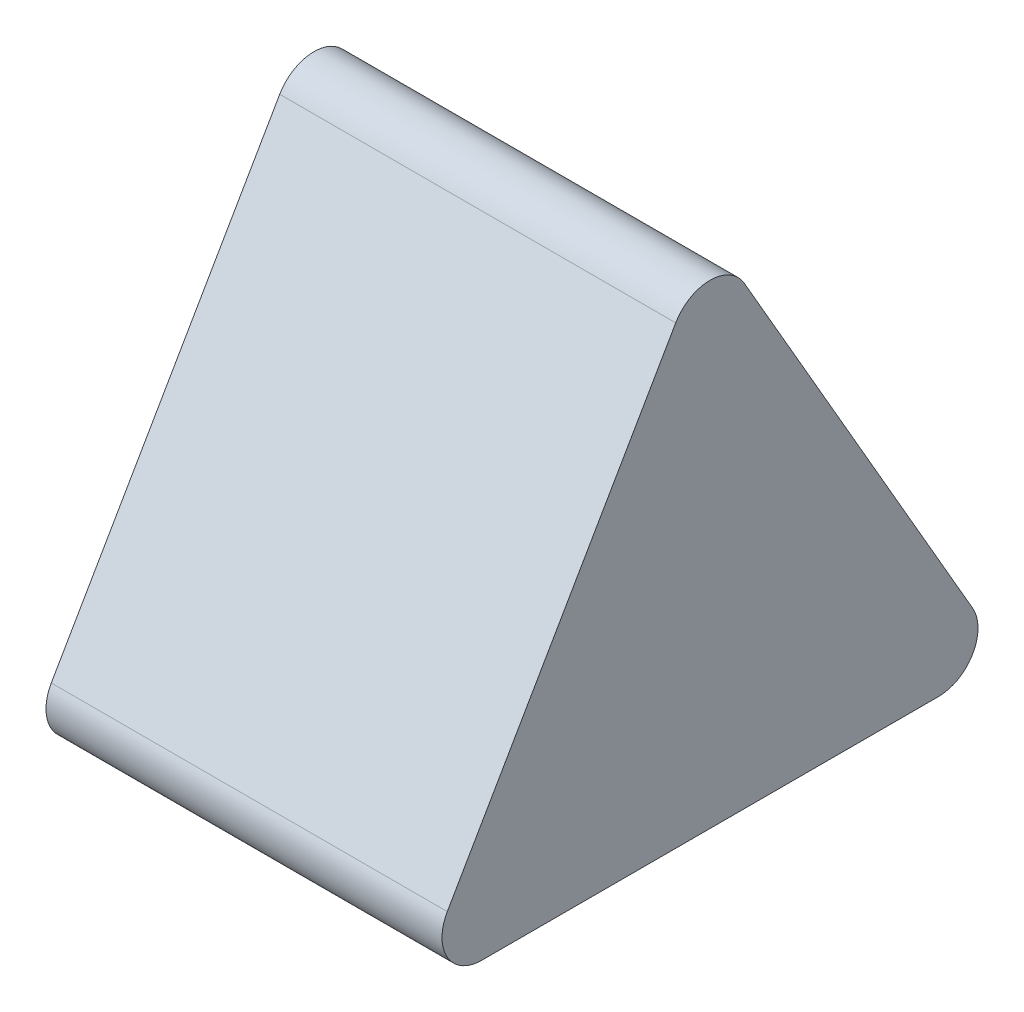
from build123d import *

# Parameters (mm, degrees)
EXTRUDE_1_DEPTH = 20
FILLET_1_R      = 2


with BuildPart() as part:
    # 草图1 → 凸台-拉伸1 (new body)
    with BuildSketch(Plane(origin=(0, 0, 0), x_dir=(0, 0, -1), z_dir=(1, 0, 0))):
        Polygon((0, 25.980762114), (0, 0), (15, 0), align=None)
        Polygon((0, 25.980762114), (-15, 0), (0, 0), align=None)
    extrude(amount=EXTRUDE_1_DEPTH)

    # 圆角1
    fillet_1_edges = [part.edges().sort_by_distance(p)[0] for p in [
        (10, 0, -15),
        (10, 0, 15),
        (10, 25.980762114, 0),
    ]]
    fillet(fillet_1_edges, radius=FILLET_1_R)


solid = part.part
